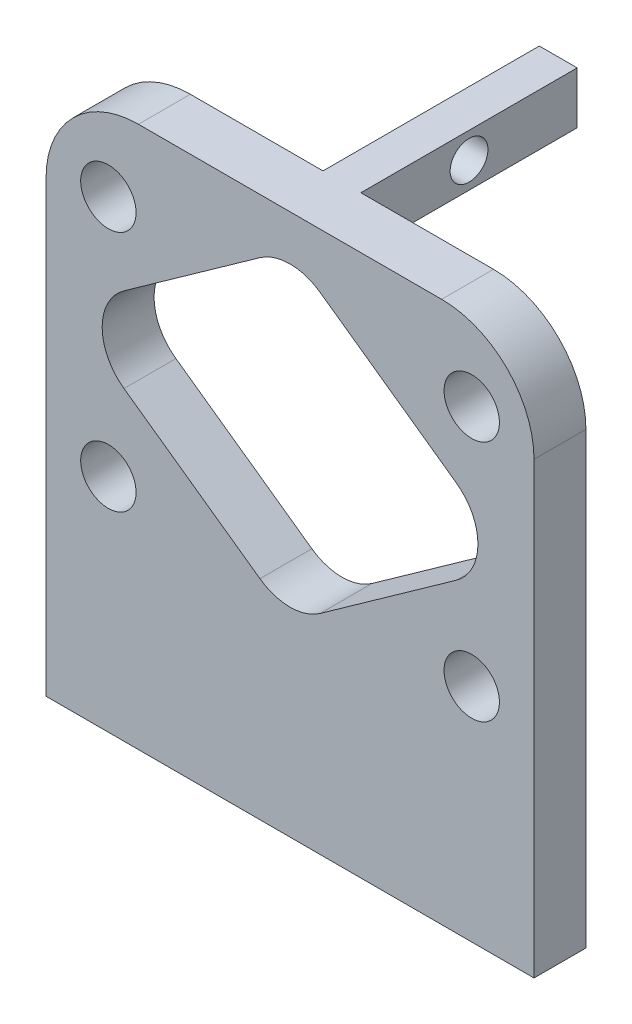
from build123d import *

# Parameters (mm, degrees)
BOSS_EXTRUDE1_DEPTH = 3
SKETCH2_R           = 1.6
CUT_EXTRUDE1_DEPTH  = 3
SKETCH3_W           = 2.188746234
SKETCH3_H           = 3
BOSS_EXTRUDE2_DEPTH = 12.5
SKETCH4_R           = 1.0926154
CUT_EXTRUDE2_DEPTH  = 12.5
SKETCH5_W           = 12.5
SKETCH5_H           = 3
SKETCH5_R           = 1.0926154
BOSS_EXTRUDE3_DEPTH = 2.188746233
SKETCH6_W           = 28.2
SKETCH6_H           = 3
BOSS_EXTRUDE4_DEPTH = 8.9


with BuildPart() as part:
    # Sketch1 → Boss-Extrude1 (new body)
    with BuildSketch(Plane.XY):
        with BuildLine():
            Line((9.576829353, 12.891428571), (37.776829353, 12.891428571))
            Line((37.776829353, 12.891428571), (37.776829353, 29.952191633))
            ThreePointArc((37.776829353, 29.952191633), (36.21300306, 33.727602279), (32.437592415, 35.291428571))
            Line((32.437592415, 35.291428571), (14.916066291, 35.291428571))
            ThreePointArc((14.916066291, 35.291428571), (11.140655646, 33.727602279), (9.576829353, 29.952191633))
            Line((9.576829353, 29.952191633), (9.576829353, 12.891428571))
        make_face()
        with BuildLine():
            Line((14.079239539, 21.646631976), (21.938160435, 16.057593806))
            ThreePointArc((21.938160435, 16.057593806), (23.676829353, 15.502390402), (25.415498271, 16.057593806))
            Line((25.415498271, 16.057593806), (33.274419167, 21.646631976))
            ThreePointArc((33.274419167, 21.646631976), (34.53575025, 24.091428571), (33.274419167, 26.536225167))
            Line((33.274419167, 26.536225167), (25.415498271, 32.125263337))
            ThreePointArc((25.415498271, 32.125263337), (23.676829353, 32.680466741), (21.938160435, 32.125263337))
            Line((21.938160435, 32.125263337), (14.079239539, 26.536225167))
            ThreePointArc((14.079239539, 26.536225167), (12.817908456, 24.091428571), (14.079239539, 21.646631976))
        make_face(mode=Mode.SUBTRACT)
    extrude(amount=BOSS_EXTRUDE1_DEPTH)

    # Sketch2 → Cut-Extrude1 (cut)
    with BuildSketch(Plane.XY.offset(3)):
        with Locations((13.176829353, 30.793016236)):
            Circle(SKETCH2_R)
        with Locations((34.176829353, 30.793016236)):
            Circle(SKETCH2_R)
        with Locations((13.176829353, 16.793016236)):
            Circle(SKETCH2_R)
        with Locations((34.176829353, 16.793016236)):
            Circle(SKETCH2_R)
    extrude(amount=-CUT_EXTRUDE1_DEPTH, mode=Mode.SUBTRACT)

    # Sketch3 → Boss-Extrude2 (add)
    with BuildSketch(Plane(origin=(0, 0, 0), x_dir=(-1, 0, 0), z_dir=(0, 0, -1))):
        with Locations((-23.676829353, 33.791428571)):
            Rectangle(SKETCH3_W, SKETCH3_H)
    extrude(amount=BOSS_EXTRUDE2_DEPTH)

    # Sketch4 → Cut-Extrude2 (cut)
    with BuildSketch(Plane(origin=(24.77120247, 0, 0), x_dir=(0, 0, -1), z_dir=(1, 0, 0))):
        with Locations((6.25, 33.791428571)):
            Circle(SKETCH4_R)
    extrude(amount=-CUT_EXTRUDE2_DEPTH, mode=Mode.SUBTRACT)



with BuildPart() as body_2:
    # Sketch5 → Boss-Extrude3 (new body)
    with BuildSketch(Plane(origin=(24.77120247, 0, 0), x_dir=(0, 0, -1), z_dir=(1, 0, 0))):
        with Locations((6.25, 5.491428571)):
            Rectangle(SKETCH5_W, SKETCH5_H)
        with Locations((6.25, 5.491428571)):
            Circle(SKETCH5_R, mode=Mode.SUBTRACT)
    extrude(amount=-BOSS_EXTRUDE3_DEPTH)


with BuildPart() as part_1:
    add(part.part)

    add(body_2.part)  # Boss-Extrude4 merges body 2
    # Sketch6 → Boss-Extrude4 (add)
    with BuildSketch(Plane.XZ.offset(-12.891428571)):
        with Locations((23.676829353, 1.5)):
            Rectangle(SKETCH6_W, SKETCH6_H)
    extrude(amount=BOSS_EXTRUDE4_DEPTH)


solid = part_1.part
